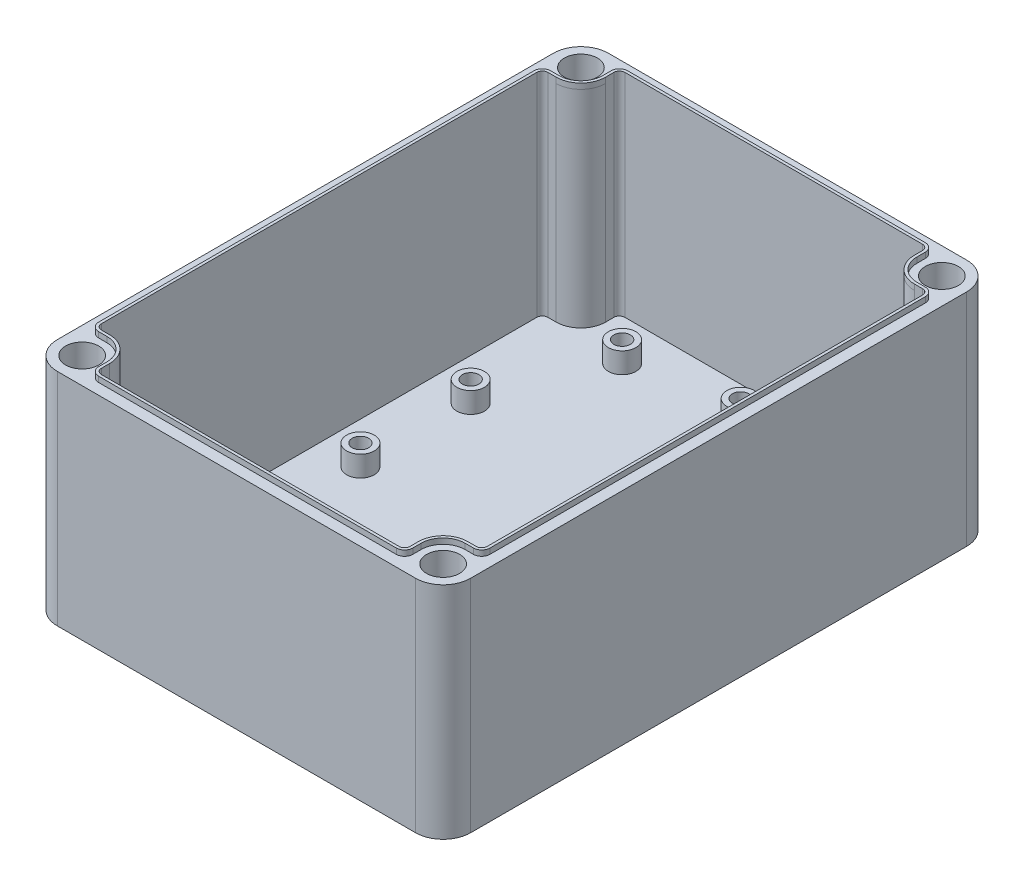
from build123d import *

# Parameters (mm, degrees)
SKETCH1_W           = 150
SKETCH1_H           = 200
BOSS_EXTRUDE1_DEPTH = 80
SKETCH2_R           = 3
HOLE_1_DEPTH        = 100
CUT_EXTRUDE2_DEPTH  = 75
FILLET1_R           = 10
BOSS_EXTRUDE2_START = 2
BOSS_EXTRUDE2_DEPTH = 2
SKETCH5_R           = 6
HOLE_2_DEPTH        = 90
SKETCH6_R           = 5
SKETCH6_R_2         = 3
BOSS_EXTRUDE3_DEPTH = 7.5


with BuildPart() as part:
    # Sketch1 → Boss-Extrude1 (new body)
    with BuildSketch(Plane(origin=(0, 0, 0), x_dir=(1, 0, 0), z_dir=(0, 1, 0))):
        with Locations((75, 100)):
            Rectangle(SKETCH1_W, SKETCH1_H)
    extrude(amount=BOSS_EXTRUDE1_DEPTH)

    # Sketch2 → Hole-1 (cut)
    with BuildSketch(Plane(origin=(0, 80, 0), x_dir=(1, 0, 0), z_dir=(0, 1, 0))):
        with Locations(Location((9.5, 190.5, 0), (0, 0, 270))):
            Circle(SKETCH2_R)
        with Locations(Location((140.5, 190.5, 0), (0, 0, 270))):
            Circle(SKETCH2_R)
        with Locations(Location((140.5, 9.5, 0), (0, 0, 270))):
            Circle(SKETCH2_R)
        with Locations(Location((9.5, 9.5, 0), (0, 0, 270))):
            Circle(SKETCH2_R)
    extrude(amount=-HOLE_1_DEPTH, mode=Mode.SUBTRACT)

    # Sketch3 → Cut-Extrude2 (cut)
    with BuildSketch(Plane(origin=(0, 80, 0), x_dir=(1, 0, 0), z_dir=(0, 1, 0))):
        with BuildLine():
            Line((21, 194.973112847), (129, 194.973112847))
            ThreePointArc((129, 194.973112847), (130.414213562, 194.387326409), (131, 192.973112847))
            Line((131, 192.973112847), (131, 189.973112847))
            ThreePointArc((131, 189.973112847), (133.645537903, 183.626537592), (140, 181))
            Line((140, 181), (143, 181))
            ThreePointArc((143, 181), (144.414213562, 180.414213562), (145, 179))
            Line((145, 179), (145, 21))
            ThreePointArc((145, 21), (144.414213562, 19.585786438), (143, 19))
            Line((143, 19), (140, 19))
            ThreePointArc((140, 19), (133.636038969, 16.363961031), (131, 10))
            Line((131, 10), (131, 7))
            ThreePointArc((131, 7), (130.414213562, 5.585786438), (129, 5))
            Line((129, 5), (21, 5))
            ThreePointArc((21, 5), (19.585786438, 5.585786438), (19, 7))
            Line((19, 7), (19, 10))
            ThreePointArc((19, 10), (16.363961031, 16.363961031), (10, 19))
            Line((10, 19), (7, 19))
            ThreePointArc((7, 19), (5.585786438, 19.585786438), (5, 21))
            Line((5, 21), (5, 179))
            ThreePointArc((5, 179), (5.585786438, 180.414213562), (7, 181))
            Line((7, 181), (10, 181))
            ThreePointArc((10, 181), (16.354462097, 183.626537592), (19, 189.973112847))
            Line((19, 189.973112847), (19, 192.973112847))
            ThreePointArc((19, 192.973112847), (19.585786438, 194.387326409), (21, 194.973112847))
        make_face()
    extrude(amount=-CUT_EXTRUDE2_DEPTH, mode=Mode.SUBTRACT)

    # Fillet1
    fillet1_edges = [part.edges().sort_by_distance(p)[0] for p in [
        (0, 40, -200),
        (150, 40, -200),
        (150, 40, 0),
        (0, 40, 0),
    ]]
    fillet(fillet1_edges, radius=FILLET1_R)

    # Sketch4 → Boss-Extrude2 (add)
    with BuildSketch(Plane(origin=(0, 80, 0), x_dir=(1, 0, 0), z_dir=(0, 1, 0)).offset(BOSS_EXTRUDE2_START)):
        with BuildLine():
            Line((4, 179), (4, 21))
            ThreePointArc((4, 21), (4.878679656, 18.878679656), (7, 18))
            Line((7, 18), (10, 18))
            ThreePointArc((10, 18), (15.656854249, 15.656854249), (18, 10))
            Line((18, 10), (18, 7))
            ThreePointArc((18, 7), (18.878679656, 4.878679656), (21, 4))
            Line((21, 4), (129, 4))
            ThreePointArc((129, 4), (131.121320344, 4.878679656), (132, 7))
            Line((132, 7), (132, 10))
            ThreePointArc((132, 10), (134.343145751, 15.656854249), (140, 18))
            Line((140, 18), (143, 18))
            ThreePointArc((143, 18), (145.121320344, 18.878679656), (146, 21))
            Line((146, 21), (146, 179))
            ThreePointArc((146, 179), (145.121320344, 181.121320344), (143, 182))
            Line((143, 182), (139.998459858, 182))
            ThreePointArc((139.998459858, 182), (134.344236882, 184.326302053), (132, 189.973112847))
            Line((132, 189.973112847), (132, 192.973112847))
            ThreePointArc((132, 192.973112847), (131.121320344, 195.09443319), (129, 195.973112847))
            Line((129, 195.973112847), (21, 195.973112847))
            ThreePointArc((21, 195.973112847), (18.878679656, 195.09443319), (18, 192.973112847))
            Line((18, 192.973112847), (18, 189.973112847))
            ThreePointArc((18, 189.973112847), (15.655763118, 184.326302053), (10.001540142, 182))
            Line((10.001540142, 182), (7, 182))
            ThreePointArc((7, 182), (4.878679656, 181.121320344), (4, 179))
        make_face()
        with BuildLine():
            Line((5, 179), (5, 21))
            ThreePointArc((5, 21), (5.585786438, 19.585786438), (7, 19))
            Line((7, 19), (10, 19))
            ThreePointArc((10, 19), (16.363961031, 16.363961031), (19, 10))
            Line((19, 10), (19, 7))
            ThreePointArc((19, 7), (19.585786438, 5.585786438), (21, 5))
            Line((21, 5), (129, 5))
            ThreePointArc((129, 5), (130.414213562, 5.585786438), (131, 7))
            Line((131, 7), (131, 10))
            ThreePointArc((131, 10), (133.636038969, 16.363961031), (140, 19))
            Line((140, 19), (143, 19))
            ThreePointArc((143, 19), (144.414213562, 19.585786438), (145, 21))
            Line((145, 21), (145, 179))
            ThreePointArc((145, 179), (144.414213562, 180.414213562), (143, 181))
            Line((143, 181), (140, 181))
            ThreePointArc((140, 181), (133.637674623, 183.61865075), (131, 189.973112847))
            Line((131, 189.973112847), (131, 192.973112847))
            ThreePointArc((131, 192.973112847), (130.414213562, 194.387326409), (129, 194.973112847))
            Line((129, 194.973112847), (21, 194.973112847))
            ThreePointArc((21, 194.973112847), (19.585786438, 194.387326409), (19, 192.973112847))
            Line((19, 192.973112847), (19, 189.973112847))
            ThreePointArc((19, 189.973112847), (16.362325377, 183.61865075), (10, 181))
            Line((10, 181), (7, 181))
            ThreePointArc((7, 181), (5.585786438, 180.414213562), (5, 179))
        make_face(mode=Mode.SUBTRACT)
    extrude(amount=-BOSS_EXTRUDE2_DEPTH)

    # Sketch5 → Hole-2 (cut)
    with BuildSketch(Plane(origin=(0, 80, 0), x_dir=(1, 0, 0), z_dir=(0, 1, 0))):
        with Locations(Location((9.5, 9.5, 0), (0, 0, 270))):
            Circle(SKETCH5_R)
        with Locations(Location((140.5, 9.5, 0), (0, 0, 270))):
            Circle(SKETCH5_R)
        with Locations(Location((140.5, 190.5, 0), (0, 0, 270))):
            Circle(SKETCH5_R)
        with Locations(Location((9.5, 190.5, 0), (0, 0, 270))):
            Circle(SKETCH5_R)
    extrude(amount=-HOLE_2_DEPTH, mode=Mode.SUBTRACT)

    # Sketch6 → Boss-Extrude3 (add)
    # profile 1 of 12: a face of its own
    with BuildSketch(Plane(origin=(0, 5, 0), x_dir=(1, 0, 0), z_dir=(0, 1, 0))):
        with Locations(Location((130, 100, 0), (0, 0, 90))):
            Circle(SKETCH6_R)
        with Locations(Location((130, 100, 0), (0, 0, 270))):
            Circle(SKETCH6_R_2, mode=Mode.SUBTRACT)
    # profile 2 of 12: a face of its own
    with BuildSketch(Plane(origin=(0, 5, 0), x_dir=(1, 0, 0), z_dir=(0, 1, 0))):
        with Locations(Location((130, 140, 0), (0, 0, 90))):
            Circle(SKETCH6_R)
        with Locations(Location((130, 140, 0), (0, 0, 270))):
            Circle(SKETCH6_R_2, mode=Mode.SUBTRACT)
    # profile 3 of 12: a face of its own
    with BuildSketch(Plane(origin=(0, 5, 0), x_dir=(1, 0, 0), z_dir=(0, 1, 0))):
        with Locations(Location((115, 179.973112847, 0), (0, 0, 90))):
            Circle(SKETCH6_R)
        with Locations(Location((115, 179.973112847, 0), (0, 0, 270))):
            Circle(SKETCH6_R_2, mode=Mode.SUBTRACT)
    # profile 4 of 12: a face of its own
    with BuildSketch(Plane(origin=(0, 5, 0), x_dir=(1, 0, 0), z_dir=(0, 1, 0))):
        with Locations(Location((35, 179.973112847, 0), (0, 0, 90))):
            Circle(SKETCH6_R)
        with Locations(Location((35, 179.973112847, 0), (0, 0, 90))):
            Circle(SKETCH6_R_2, mode=Mode.SUBTRACT)
    # profile 5 of 12: a face of its own
    with BuildSketch(Plane(origin=(0, 5, 0), x_dir=(1, 0, 0), z_dir=(0, 1, 0))):
        with Locations(Location((20, 140, 0), (0, 0, 90))):
            Circle(SKETCH6_R)
        with Locations(Location((20, 140, 0), (0, 0, 90))):
            Circle(SKETCH6_R_2, mode=Mode.SUBTRACT)
    # profile 6 of 12: a face of its own
    with BuildSketch(Plane(origin=(0, 5, 0), x_dir=(1, 0, 0), z_dir=(0, 1, 0))):
        with Locations(Location((20, 100, 0), (0, 0, 90))):
            Circle(SKETCH6_R)
        with Locations(Location((20, 100, 0), (0, 0, 90))):
            Circle(SKETCH6_R_2, mode=Mode.SUBTRACT)
    # profile 7 of 12: a face of its own
    with BuildSketch(Plane(origin=(0, 5, 0), x_dir=(1, 0, 0), z_dir=(0, 1, 0))):
        with Locations(Location((75, 182.973112847, 0), (0, 0, 90))):
            Circle(SKETCH6_R)
        with Locations(Location((75, 182.973112847, 0), (0, 0, 270))):
            Circle(SKETCH6_R_2, mode=Mode.SUBTRACT)
    # profile 8 of 12: a face of its own
    with BuildSketch(Plane(origin=(0, 5, 0), x_dir=(1, 0, 0), z_dir=(0, 1, 0))):
        with Locations(Location((75, 17.026887153, 0), (0, 0, 90))):
            Circle(SKETCH6_R)
        with Locations(Location((75, 17.026887153, 0), (0, 0, 90))):
            Circle(SKETCH6_R_2, mode=Mode.SUBTRACT)
    # profile 9 of 12: a face of its own
    with BuildSketch(Plane(origin=(0, 5, 0), x_dir=(1, 0, 0), z_dir=(0, 1, 0))):
        with Locations(Location((20, 60, 0), (0, 0, 90))):
            Circle(SKETCH6_R)
        with Locations(Location((20, 60, 0), (0, 0, 270))):
            Circle(SKETCH6_R_2, mode=Mode.SUBTRACT)
    # profile 10 of 12: a face of its own
    with BuildSketch(Plane(origin=(0, 5, 0), x_dir=(1, 0, 0), z_dir=(0, 1, 0))):
        with Locations(Location((35, 20.026887153, 0), (0, 0, 90))):
            Circle(SKETCH6_R)
        with Locations(Location((35, 20.026887153, 0), (0, 0, 270))):
            Circle(SKETCH6_R_2, mode=Mode.SUBTRACT)
    # profile 11 of 12: a face of its own
    with BuildSketch(Plane(origin=(0, 5, 0), x_dir=(1, 0, 0), z_dir=(0, 1, 0))):
        with Locations(Location((115, 20.026887153, 0), (0, 0, 90))):
            Circle(SKETCH6_R)
        with Locations(Location((115, 20.026887153, 0), (0, 0, 90))):
            Circle(SKETCH6_R_2, mode=Mode.SUBTRACT)
    # profile 12 of 12: a face of its own
    with BuildSketch(Plane(origin=(0, 5, 0), x_dir=(1, 0, 0), z_dir=(0, 1, 0))):
        with Locations(Location((130, 60, 0), (0, 0, 90))):
            Circle(SKETCH6_R)
        with Locations(Location((130, 60, 0), (0, 0, 90))):
            Circle(SKETCH6_R_2, mode=Mode.SUBTRACT)
    extrude(amount=BOSS_EXTRUDE3_DEPTH)


solid = part.part
